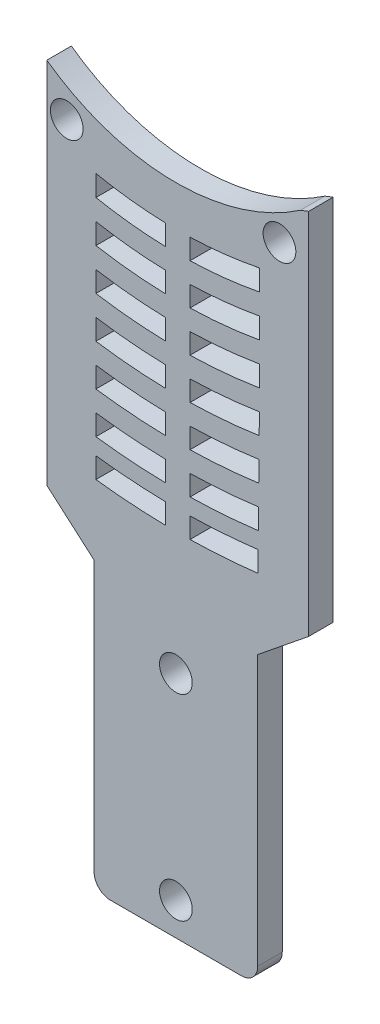
from build123d import *

# Parameters (mm, degrees)
SKETCH1_W                    = 20
SKETCH1_H                    = 35
BOSS_EXTRUDE1_DEPTH          = 3
FILLET5_R                    = 2
F_97_0_0059_DIAMETER_HOLE2_D = 3.000000096
F_97_0_0059_DIAMETER_HOLE4_D = 3.000000096
F_97_0_0059_DIAMETER_HOLE6_D = 3.000000096
F_97_0_0059_DIAMETER_HOLE7_D = 3.000000096
CUT_EXTRUDE1_DEPTH           = 3
BOSS_EXTRUDE3_START          = -3
SKETCH17_R                   = 1.500000048
BOSS_EXTRUDE3_DEPTH          = 3
CUT_EXTRUDE3_START           = -3
CUT_EXTRUDE3_DEPTH           = 3
SKETCH19_R                   = 2
CUT_EXTRUDE4_DEPTH           = 10
SKETCH20_R                   = 2
CUT_EXTRUDE6_DEPTH           = 10


with BuildPart() as part:
    # Sketch1 → Boss-Extrude1 (new body)
    with BuildSketch(Plane.XY):
        with BuildLine():
            Line((-16, 22.5), (-16, -22.5))
            Line((-16, -22.5), (16, -22.5))
            Line((16, -22.5), (16, 22.5))
            ThreePointArc((16, 22.5), (0, 19.418681543), (-16, 22.5))
        make_face()
        with Locations((-0.22513797, -45.024704694)):
            Rectangle(SKETCH1_W, SKETCH1_H)
        Polygon((9.77486203, -27.524704694), (-10.22513797, -27.524704694), (-16, -22.5), (16, -22.5), align=None)
    extrude(amount=BOSS_EXTRUDE1_DEPTH)

    # Fillet5
    fillet5_edges = [part.edges().sort_by_distance(p)[0] for p in [
        (9.77486203, -62.524704694, 1.5),
        (-10.22513797, -62.524704694, 1.5),
    ]]
    fillet(fillet5_edges, radius=FILLET5_R)

    # #97 (0.0059) Diameter Hole2 (through all)
    with Locations(Plane(origin=(-0.22513797, -57.524704694, 3), x_dir=(1, 0, 0), z_dir=(0, 0, 1))):
        with Locations((0, 0)):
            Hole(F_97_0_0059_DIAMETER_HOLE2_D / 2)

    # #97 (0.0059) Diameter Hole4 (through all)
    with Locations(Plane(origin=(-0.22513797, -32.524704694, 3), x_dir=(1, 0, 0), z_dir=(0, 0, 1))):
        with Locations((0, 0)):
            Hole(F_97_0_0059_DIAMETER_HOLE4_D / 2)

    # #97 (0.0059) Diameter Hole6 (through all)
    with Locations(Plane(origin=(-13.971666748, 19.647656364, 3), x_dir=(1, 0, 0), z_dir=(0, 0, 1))):
        with Locations((0, 0)):
            Hole(F_97_0_0059_DIAMETER_HOLE6_D / 2)

    # #97 (0.0059) Diameter Hole7 (through all)
    with Locations(Plane(origin=(13.932427901, 19.6445071, 3), x_dir=(1, 0, 0), z_dir=(0, 0, 1))):
        with Locations((0, 0)):
            Hole(F_97_0_0059_DIAMETER_HOLE7_D / 2)

    # Sketch15 → Cut-Extrude1 (cut)
    with BuildSketch(Plane.XY.offset(3)):
        with BuildLine():
            ThreePointArc((10, 13.510205144), (5.771168674, 12.834180646), (1.5, 12.522505065))
            Line((1.5, 12.522505065), (1.5, 10.021432946))
            ThreePointArc((1.5, 10.021432946), (5.769166403, 10.317946389), (10, 10.96117968))
            Line((10, 10.96117968), (10, 13.510205144))
        make_face()
        with BuildLine():
            Line((-1.5, 10.021432946), (-1.5, 12.522505065))
            ThreePointArc((-1.5, 12.522505065), (-5.771168674, 12.834180646), (-10, 13.510205144))
            Line((-10, 13.510205144), (-10, 10.96117968))
            ThreePointArc((-10, 10.96117968), (-5.769166403, 10.317946389), (-1.5, 10.021432946))
        make_face()
        with BuildLine():
            Line((-1.5, 5.019568547), (-1.5, 7.52045835))
            ThreePointArc((-1.5, 7.52045835), (-5.767436702, 7.803229767), (-10, 8.416730868))
            Line((-10, 8.416730868), (-10, 5.876241735))
            ThreePointArc((-10, 5.876241735), (-5.765932035, 5.289825837), (-1.5, 5.019568547))
        make_face()
        with BuildLine():
            ThreePointArc((10, 8.416730868), (5.767436702, 7.803229767), (1.5, 7.52045835))
            Line((1.5, 7.52045835), (1.5, 5.019568547))
            ThreePointArc((1.5, 5.019568547), (5.765932035, 5.289825837), (10, 5.876241735))
            Line((10, 5.876241735), (10, 8.416730868))
        make_face()
        with BuildLine():
            Line((-1.5, 0.018002593), (-1.5, 2.518752931))
            ThreePointArc((-1.5, 2.518752931), (-5.764614839, 2.777565222), (-10, 3.339202169))
            Line((-10, 3.339202169), (-10, 0.805186604))
            ThreePointArc((-10, 0.805186604), (-5.763455098, 0.266306671), (-1.5, 0.018002593))
        make_face()
        with BuildLine():
            ThreePointArc((10, 3.339202169), (5.764614839, 2.777565222), (1.5, 2.518752931))
            Line((1.5, 2.518752931), (1.5, 0.018002593))
            ThreePointArc((1.5, 0.018002593), (5.763455098, 0.266306671), (10, 0.805186604))
            Line((10, 0.805186604), (10, 3.339202169))
        make_face()
        with BuildLine():
            Line((-1.5, -4.983331275), (-1.5, -2.482690003))
            ThreePointArc((-1.5, -2.482690003), (-5.762428595, -2.244068583), (-10, -1.726162893))
            Line((-10, -1.726162893), (-10, -4.255149614))
            ThreePointArc((-10, -4.255149614), (-5.761515611, -4.753661148), (-1.5, -4.983331275))
        make_face()
        with BuildLine():
            ThreePointArc((9.981645143, -1.729018054), (5.753177309, -2.244891311), (1.5, -2.482690003))
            Line((1.5, -2.482690003), (1.5, -4.983331275))
            ThreePointArc((1.5, -4.983331275), (5.738725767, -4.755609629), (9.95475653, -4.261911465))
            Line((9.95475653, -4.261911465), (9.981645143, -1.729018054))
        make_face()
        with BuildLine():
            Line((-1.5, -9.984481098), (-1.5, -7.483926726))
            ThreePointArc((-1.5, -7.483926726), (-5.760699953, -7.262556834), (-10, -6.782032303))
            Line((-10, -6.782032303), (-10, -9.307033082))
            ThreePointArc((-10, -9.307033082), (-5.759968225, -9.770829288), (-1.5, -9.984481098))
        make_face()
        with BuildLine():
            ThreePointArc((9.927893429, -6.792401691), (5.724398551, -7.265544943), (1.5, -7.483926726))
            Line((1.5, -7.483926726), (1.5, -9.984481098))
            ThreePointArc((1.5, -9.984481098), (5.710178647, -9.774780247), (9.901053138, -9.320743151))
            Line((9.901053138, -9.320743151), (9.927893429, -6.792401691))
        make_face()
        with BuildLine():
            Line((-1.5, -14.985482511), (-1.5, -12.4849985))
            ThreePointArc((-1.5, -12.4849985), (-5.759309265, -12.278542088), (-10, -11.830343737))
            Line((-10, -11.830343737), (-10, -14.352130745))
            ThreePointArc((-10, -14.352130745), (-5.758713712, -14.78575041), (-1.5, -14.985482511))
        make_face()
        with BuildLine():
            Line((-1.5, -19.48627934), (-1.5, -16.985847797))
            ThreePointArc((-1.5, -16.985847797), (-5.758277571, -16.791186392), (-10, -16.368561544))
            Line((-10, -16.368561544), (-10, -18.887959798))
            ThreePointArc((-10, -18.887959798), (-5.757777051, -19.297603898), (-1.5, -19.48627934))
        make_face()
        with BuildLine():
            ThreePointArc((9.82600299, -16.390428223), (5.67082155, -16.797489134), (1.5, -16.985847797))
            Line((1.5, -16.985847797), (1.5, -19.48627934))
            ThreePointArc((1.5, -19.48627934), (5.656897905, -19.304642326), (9.799230566, -18.912376702))
            Line((9.799230566, -18.912376702), (9.82600299, -16.390428223))
        make_face()
        with BuildLine():
            ThreePointArc((9.874233328, -11.847155401), (5.69605187, -12.283387146), (1.5, -12.4849985))
            Line((1.5, -12.4849985), (1.5, -14.985482511))
            ThreePointArc((1.5, -14.985482511), (5.682006317, -14.791427754), (9.847431975, -14.371828933))
            Line((9.847431975, -14.371828933), (9.874233328, -11.847155401))
        make_face()
    extrude(amount=-CUT_EXTRUDE1_DEPTH, mode=Mode.SUBTRACT)

    # Sketch17 → Boss-Extrude3 (add)
    with BuildSketch(Plane.XY.offset(3).offset(BOSS_EXTRUDE3_START)):
        with Locations((-0.22513797, -57.524704694)):
            Circle(SKETCH17_R)
        with Locations((-0.22513797, -32.524704694)):
            Circle(SKETCH17_R)
        with Locations((-13.971666748, 19.647656364)):
            Circle(SKETCH17_R)
        with Locations((13.932427901, 19.6445071)):
            Circle(SKETCH17_R)
    extrude(amount=BOSS_EXTRUDE3_DEPTH)

    # Sketch18 → Cut-Extrude3 (cut)
    with BuildSketch(Plane.XY.offset(3).offset(CUT_EXTRUDE3_START)):
        with BuildLine():
            ThreePointArc((-16, 22.5), (-8.51081333, 18.724422317), (-0.22513797, 17.424234775))
            Line((-0.22513797, 17.424234775), (-0.22513797, 19.419269819))
            ThreePointArc((-0.22513797, 19.419269819), (-8.257511741, 20.217456322), (-16, 22.5))
        make_face()
        with BuildLine():
            Line((-0.22513797, 19.419269819), (-0.22513797, 17.424234775))
            ThreePointArc((-0.22513797, 17.424234775), (7.738274372, 18.622946482), (14.995922473, 22.11284475))
            ThreePointArc((14.995922473, 22.11284475), (7.507186902, 20.077810702), (-0.22513797, 19.419269819))
        make_face()
    extrude(amount=CUT_EXTRUDE3_DEPTH, mode=Mode.SUBTRACT)

    # Sketch19 → Cut-Extrude4 (cut)
    with BuildSketch(Plane.XY.offset(3)):
        with Locations((-0.22513797, -34.524704694)):
            Circle(SKETCH19_R)
        with Locations((-0.22513797, -58.524704694)):
            Circle(SKETCH19_R)
    extrude(amount=-CUT_EXTRUDE4_DEPTH, mode=Mode.SUBTRACT)

    # Sketch20 → Cut-Extrude6 (cut)
    with BuildSketch(Plane(origin=(0, 0, 0), x_dir=(-1, 0, 0), z_dir=(0, 0, -1))):
        with Locations((13.562993481, 17.426344688)):
            Circle(SKETCH20_R)
        with Locations((-12.437006519, 17.426344688)):
            Circle(SKETCH20_R)
    extrude(amount=-CUT_EXTRUDE6_DEPTH, mode=Mode.SUBTRACT)


solid = part.part
